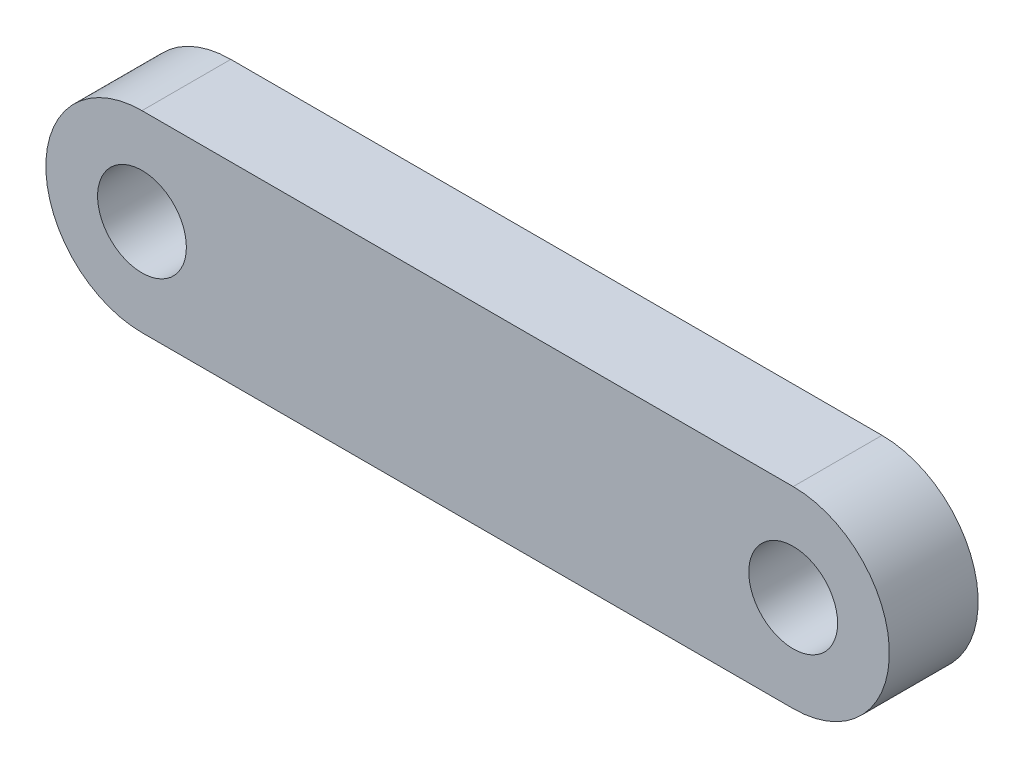
from build123d import *

# Parameters (mm, degrees)
SKETCH_1_R      = 1.5
EXTRUDE_1_DEPTH = 3


with BuildPart() as part:
    # 草圖1 → 填料-伸長1 (new body)
    with BuildSketch(Plane.XY):
        with BuildLine():
            Line((221.299311625, 136.984616508), (199.299311625, 136.98352231))
            ThreePointArc((199.299311625, 136.98352231), (196.051533934, 133.735744619), (199.299311625, 130.487966928))
            Line((199.299311625, 130.487966928), (221.299311625, 130.487966928))
            ThreePointArc((221.299311625, 130.487966928), (224.547595155, 133.736291718), (221.299311625, 136.984616508))
        make_face()
        with Locations((199.299311625, 133.735744619)):
            Circle(SKETCH_1_R, mode=Mode.SUBTRACT)
        with Locations((221.299311625, 133.735744619)):
            Circle(SKETCH_1_R, mode=Mode.SUBTRACT)
    extrude(amount=EXTRUDE_1_DEPTH)


solid = part.part
